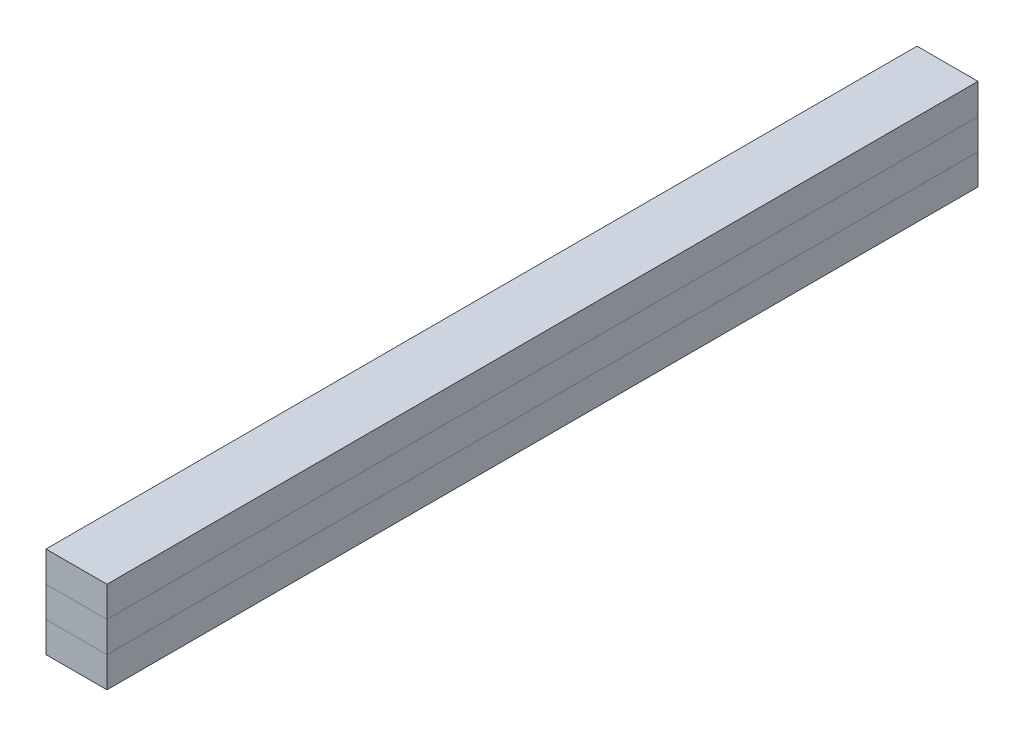
from build123d import *

# Parameters (mm, degrees)
SZKIC1_W                    = 14
SZKIC1_H                    = 21
DODANIE_WYCI_GNI_CIE2_DEPTH = 200
PODZIEL1_SURFACE_1_1_BACK   = 202.586
PODZIEL1_SURFACE_1_1_DEPTH  = 405.172
PODZIEL1_SURFACE_1_2_BACK   = 202.586
PODZIEL1_SURFACE_1_2_DEPTH  = 405.172
PODZIEL1_SURFACE_3_3_BACK   = 202.586
PODZIEL1_SURFACE_3_3_DEPTH  = 405.172
PODZIEL1_SURFACE_3_4_BACK   = 202.586
PODZIEL1_SURFACE_3_4_DEPTH  = 405.172


with BuildPart() as part:
    # Szkic1 → Dodanie-wyciągnięcie2 (new body)
    with BuildSketch(Plane.XY):
        with Locations((7, 10.5)):
            Rectangle(SZKIC1_W, SZKIC1_H)
    extrude(amount=DODANIE_WYCI_GNI_CIE2_DEPTH)


with BuildPart() as body_2:
    # Podziel1: the piece behind the surface
    add(part.part)
    # Podziel1 surface 1: a surface, the sketch's curves swept straight by 405.172 mm
    with BuildLine(Plane.XY.offset(-PODZIEL1_SURFACE_1_1_BACK), mode=Mode.PRIVATE) as podziel1_surface_1_1_path:
        Line((0, 14), (14, 14))
    podziel1_surface_1_1 = Shell.extrude(podziel1_surface_1_1_path.wire(), (0 * PODZIEL1_SURFACE_1_1_DEPTH, 0 * PODZIEL1_SURFACE_1_1_DEPTH, 1 * PODZIEL1_SURFACE_1_1_DEPTH))
    split(bisect_by=podziel1_surface_1_1, keep=Keep.BOTTOM)


with BuildPart() as part_1:
    add(part.part)

    # Podziel1: split by a surface, the side it looks to stays
    # Podziel1 surface 1: a surface, the sketch's curves swept straight by 405.172 mm
    with BuildLine(Plane.XY.offset(-PODZIEL1_SURFACE_1_2_BACK), mode=Mode.PRIVATE) as podziel1_surface_1_2_path:
        Line((0, 14), (14, 14))
    podziel1_surface_1_2 = Shell.extrude(podziel1_surface_1_2_path.wire(), (0 * PODZIEL1_SURFACE_1_2_DEPTH, 0 * PODZIEL1_SURFACE_1_2_DEPTH, 1 * PODZIEL1_SURFACE_1_2_DEPTH))
    split(bisect_by=podziel1_surface_1_2, keep=Keep.TOP)


with BuildPart() as body_3_2:
    # Podziel1 3 body 2: the piece behind the surface
    add(body_2.part)
    # Podziel1 surface 3: a surface, the sketch's curves swept straight by 405.172 mm
    with BuildLine(Plane.XY.offset(-PODZIEL1_SURFACE_3_3_BACK), mode=Mode.PRIVATE) as podziel1_surface_3_3_path:
        Line((0, 7), (14, 7))
    podziel1_surface_3_3 = Shell.extrude(podziel1_surface_3_3_path.wire(), (0 * PODZIEL1_SURFACE_3_3_DEPTH, 0 * PODZIEL1_SURFACE_3_3_DEPTH, 1 * PODZIEL1_SURFACE_3_3_DEPTH))
    split(bisect_by=podziel1_surface_3_3, keep=Keep.BOTTOM)


with BuildPart() as body_2_1:
    add(body_2.part)

    # Podziel1 3 body 2: split by a surface, the side it looks to stays
    # Podziel1 surface 3: a surface, the sketch's curves swept straight by 405.172 mm
    with BuildLine(Plane.XY.offset(-PODZIEL1_SURFACE_3_4_BACK), mode=Mode.PRIVATE) as podziel1_surface_3_4_path:
        Line((0, 7), (14, 7))
    podziel1_surface_3_4 = Shell.extrude(podziel1_surface_3_4_path.wire(), (0 * PODZIEL1_SURFACE_3_4_DEPTH, 0 * PODZIEL1_SURFACE_3_4_DEPTH, 1 * PODZIEL1_SURFACE_3_4_DEPTH))
    split(bisect_by=podziel1_surface_3_4, keep=Keep.TOP)


solid = Compound([part_1.part, body_3_2.part, body_2_1.part])
